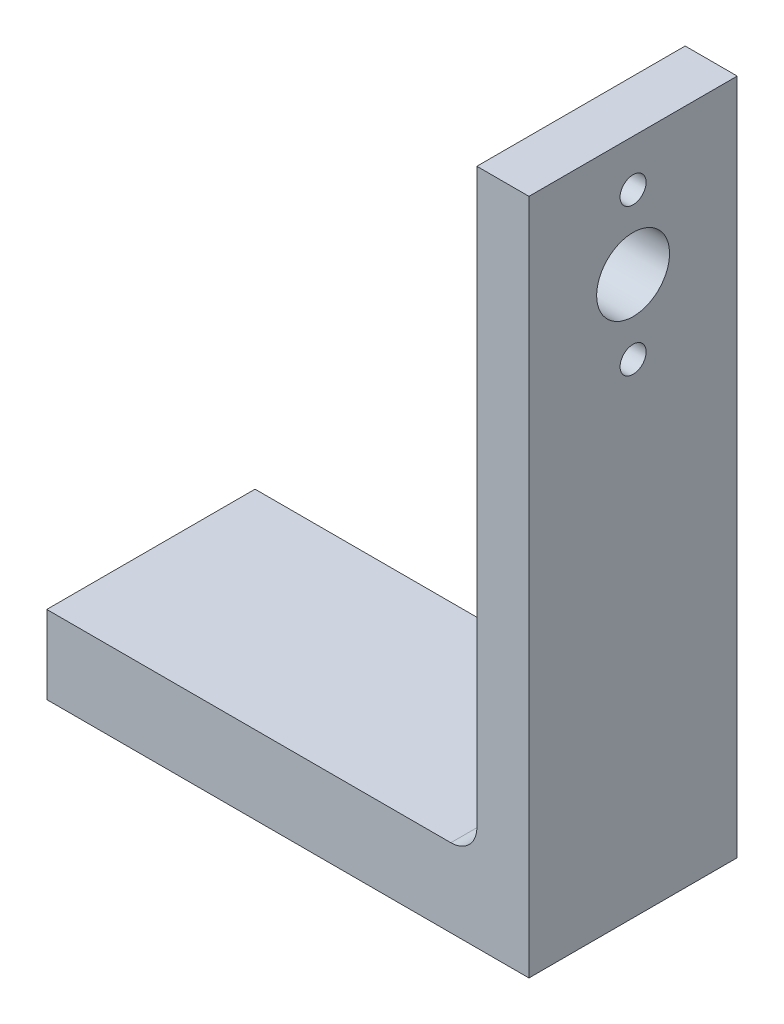
from build123d import *

# Parameters (mm, degrees)
BOSS_EXTRUDE1_DEPTH        = 25.4
SKETCH2_R                  = 4.445
SKETCH2_R_2                = 1.5875
CUT_EXTRUDE1_DEPTH         = 88.683921143
F_10_32_TAPPED_HOLE1_D     = 4.0386
F_10_32_TAPPED_HOLE1_DEPTH = 11.938
F_10_32_TAPPED_HOLE1_TIP   = 1.213317848
FILLET1_R                  = 3.175


with BuildPart() as part:
    # Sketch1 → Boss-Extrude1 (new body)
    with BuildSketch(Plane.XY):
        Polygon((-57.15, -17.035096154), (1.651, -17.035096154), (1.651, 65.514903846), (-4.699, 65.514903846), (-4.699, -7.510096154), (-57.15, -7.510096154), align=None)
    extrude(amount=BOSS_EXTRUDE1_DEPTH)

    # Sketch2 → Cut-Extrude1 (cut, through all)
    with BuildSketch(Plane.ZY.offset(4.699)):
        with Locations(Location((12.7, 50.909903846, 0), (0, 0, 270))):
            Circle(SKETCH2_R)
        with Locations(Location((12.7, 59.863403846, 0), (0, 0, 270))):
            Circle(SKETCH2_R_2)
        with Locations(Location((12.7, 41.956403846, 0), (0, 0, 270))):
            Circle(SKETCH2_R_2)
    extrude(amount=-CUT_EXTRUDE1_DEPTH, mode=Mode.SUBTRACT)

    # #10-32 Tapped Hole1
    with Locations(Plane.ZY.offset(57.15)):
        with Locations((6.985, -12.272596154), (18.415, -12.272596154)):
            Hole(F_10_32_TAPPED_HOLE1_D / 2, depth=F_10_32_TAPPED_HOLE1_DEPTH)
            with Locations((0, 0, -(F_10_32_TAPPED_HOLE1_DEPTH + F_10_32_TAPPED_HOLE1_TIP / 2))):  # 118° drill point
                Cone(0, F_10_32_TAPPED_HOLE1_D / 2, F_10_32_TAPPED_HOLE1_TIP, mode=Mode.SUBTRACT)

    # Fillet1
    fillet1_edges = [part.edges().sort_by_distance(p)[0] for p in [
        (-4.699, -7.510096154, 12.7),
    ]]
    fillet(fillet1_edges, radius=FILLET1_R)


solid = part.part
